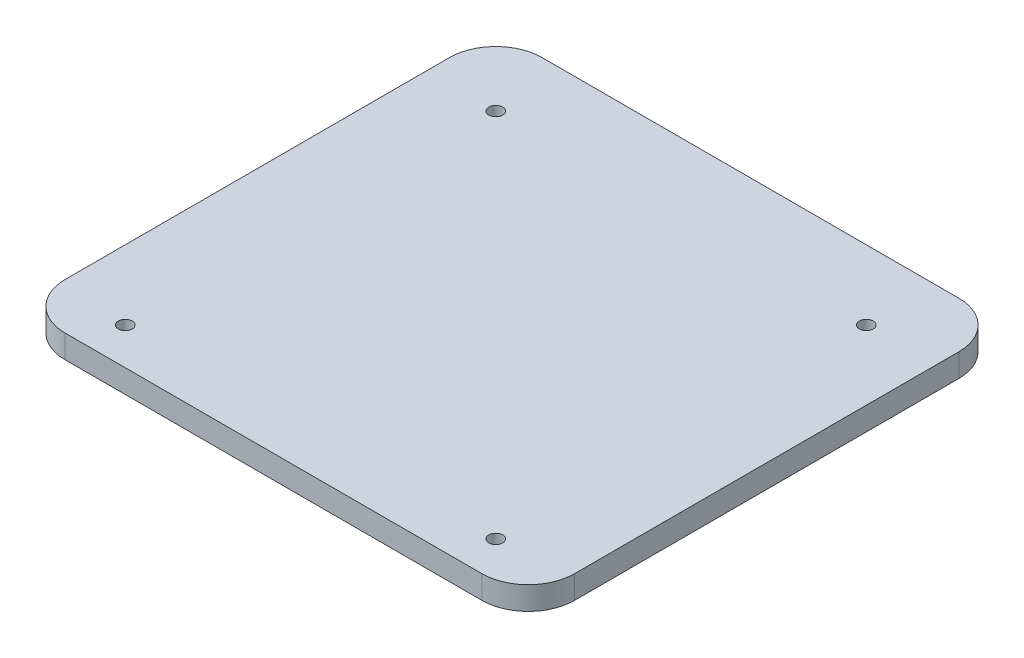
from build123d import *

# Parameters (mm, degrees)
SKETCH2_W           = 110
SKETCH2_H           = 103
SKETCH2_R           = 1.5
BOSS_EXTRUDE1_DEPTH = 5
FILLET1_R           = 10


with BuildPart() as part:
    # Sketch2 → Boss-Extrude1 (new body)
    with BuildSketch(Plane(origin=(0, 0, 0), x_dir=(1, 0, 0), z_dir=(0, 1, 0))):
        Rectangle(SKETCH2_W, SKETCH2_H)
        with Locations(Location((-40, -43.5, 0), (0, 0, 270))):
            Circle(SKETCH2_R, mode=Mode.SUBTRACT)
        with Locations(Location((-40, 36.5, 0), (0, 0, 270))):
            Circle(SKETCH2_R, mode=Mode.SUBTRACT)
        with Locations(Location((40, -43.5, 0), (0, 0, 270))):
            Circle(SKETCH2_R, mode=Mode.SUBTRACT)
        with Locations(Location((40, 36.5, 0), (0, 0, 270))):
            Circle(SKETCH2_R, mode=Mode.SUBTRACT)
    extrude(amount=BOSS_EXTRUDE1_DEPTH)

    # Fillet1
    fillet1_edges = [part.edges().sort_by_distance(p)[0] for p in [
        (55, 2.5, 51.5),
        (-55, 2.5, 51.5),
        (-55, 2.5, -51.5),
        (55, 2.5, -51.5),
    ]]
    fillet(fillet1_edges, radius=FILLET1_R)


solid = part.part
